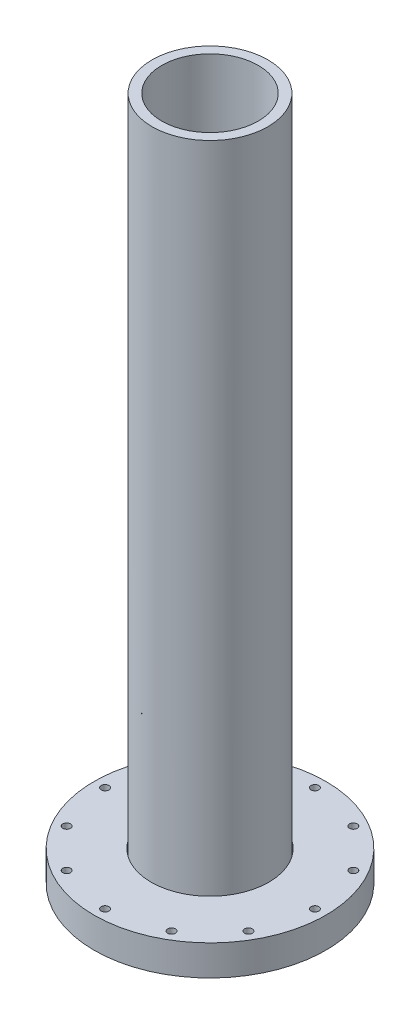
from build123d import *

# Parameters (mm, degrees)
SKETCH1_R                        = 38.1
SKETCH1_R_2                      = 31.75
BOSS_EXTRUDE1_DEPTH              = 450
SKETCH2_R                        = 76.2
SKETCH2_R_2                      = 38.6715
BOSS_EXTRUDE2_DEPTH              = 20
SKETCH5_W                        = 2.5527
SKETCH5_H                        = 450
F_10_CLEARANCE_HOLE1_AT_2_COUNT  = 2
F_10_CLEARANCE_HOLE1_AT_2_PITCH  = 35.717028224
F_10_CLEARANCE_HOLE1_AT_3_COUNT  = 2
F_10_CLEARANCE_HOLE1_AT_3_PITCH  = 69
F_10_CLEARANCE_HOLE1_AT_4_COUNT  = 2
F_10_CLEARANCE_HOLE1_AT_4_PITCH  = 97.580735804
F_10_CLEARANCE_HOLE1_AT_5_COUNT  = 2
F_10_CLEARANCE_HOLE1_AT_5_PITCH  = 119.511505722
F_10_CLEARANCE_HOLE1_AT_6_COUNT  = 2
F_10_CLEARANCE_HOLE1_AT_6_PITCH  = 133.297764028
F_10_CLEARANCE_HOLE1_AT_7_COUNT  = 2
F_10_CLEARANCE_HOLE1_AT_7_PITCH  = 138
F_10_CLEARANCE_HOLE1_AT_8_COUNT  = 2
F_10_CLEARANCE_HOLE1_AT_8_PITCH  = 133.297764028
F_10_CLEARANCE_HOLE1_AT_9_COUNT  = 2
F_10_CLEARANCE_HOLE1_AT_9_PITCH  = 119.511505722
F_10_CLEARANCE_HOLE1_AT_10_COUNT = 2
F_10_CLEARANCE_HOLE1_AT_10_PITCH = 97.580735804
F_10_CLEARANCE_HOLE1_AT_11_COUNT = 2
F_10_CLEARANCE_HOLE1_AT_11_PITCH = 69
F_10_CLEARANCE_HOLE1_AT_12_COUNT = 2
F_10_CLEARANCE_HOLE1_AT_12_PITCH = 35.717028224
SKETCH6_R                        = 55.14
CUT_EXTRUDE1_DEPTH               = 2


with BuildPart() as part:
    # Sketch1 → Boss-Extrude1 (new body)
    with BuildSketch(Plane(origin=(0, 0, 0), x_dir=(1, 0, 0), z_dir=(0, 1, 0))):
        Circle(SKETCH1_R)
        Circle(SKETCH1_R_2, mode=Mode.SUBTRACT)
    extrude(amount=BOSS_EXTRUDE1_DEPTH)


with BuildPart() as body_2:
    # Sketch2 → Boss-Extrude2 (new body)
    with BuildSketch(Plane(origin=(0, 0, 0), x_dir=(1, 0, 0), z_dir=(0, 1, 0))):
        Circle(SKETCH2_R)
        Circle(SKETCH2_R_2, mode=Mode.SUBTRACT)
    extrude(amount=BOSS_EXTRUDE2_DEPTH)

    # Sketch5 → #10 Clearance Hole1 (revolve, cut)
    with BuildSketch(Plane(origin=(69, 0, 0), x_dir=(0, 0, -1), z_dir=(1, 0, 0))):
        with Locations((1.27635, 225)):
            Rectangle(SKETCH5_W, SKETCH5_H)
    f_10_clearance_hole1 = revolve(axis=Axis((69, -6.35, 0), (0, 1, 0)), mode=Mode.SUBTRACT)

    # #10 Clearance Hole1 at 2: #10 Clearance Hole1 ×2
    with Locations(*[Vector(-0.25881904510252135, 0, -0.9659258262890681) * (i * F_10_CLEARANCE_HOLE1_AT_2_PITCH) for i in range(1, F_10_CLEARANCE_HOLE1_AT_2_COUNT)]):
        add(f_10_clearance_hole1, mode=Mode.SUBTRACT)

    # #10 Clearance Hole1 at 3: #10 Clearance Hole1 ×2
    with Locations(*[Vector(-0.5000000000000009, 0, -0.8660254037844382) * (i * F_10_CLEARANCE_HOLE1_AT_3_PITCH) for i in range(1, F_10_CLEARANCE_HOLE1_AT_3_COUNT)]):
        add(f_10_clearance_hole1, mode=Mode.SUBTRACT)

    # #10 Clearance Hole1 at 4: #10 Clearance Hole1 ×2
    with Locations(*[Vector(-0.7071067811865487, 0, -0.7071067811865464) * (i * F_10_CLEARANCE_HOLE1_AT_4_PITCH) for i in range(1, F_10_CLEARANCE_HOLE1_AT_4_COUNT)]):
        add(f_10_clearance_hole1, mode=Mode.SUBTRACT)

    # #10 Clearance Hole1 at 5: #10 Clearance Hole1 ×2
    with Locations(*[Vector(-0.8660254037844397, 0, -0.49999999999999817) * (i * F_10_CLEARANCE_HOLE1_AT_5_PITCH) for i in range(1, F_10_CLEARANCE_HOLE1_AT_5_COUNT)]):
        add(f_10_clearance_hole1, mode=Mode.SUBTRACT)

    # #10 Clearance Hole1 at 6: #10 Clearance Hole1 ×2
    with Locations(*[Vector(-0.9659258262890691, 0, -0.258819045102518) * (i * F_10_CLEARANCE_HOLE1_AT_6_PITCH) for i in range(1, F_10_CLEARANCE_HOLE1_AT_6_COUNT)]):
        add(f_10_clearance_hole1, mode=Mode.SUBTRACT)

    # #10 Clearance Hole1 at 7: #10 Clearance Hole1 ×2
    with Locations(*[(-i * F_10_CLEARANCE_HOLE1_AT_7_PITCH, 0, 0) for i in range(1, F_10_CLEARANCE_HOLE1_AT_7_COUNT)]):
        add(f_10_clearance_hole1, mode=Mode.SUBTRACT)

    # #10 Clearance Hole1 at 8: #10 Clearance Hole1 ×2
    with Locations(*[Vector(-0.9659258262890672, 0, 0.2588190451025248) * (i * F_10_CLEARANCE_HOLE1_AT_8_PITCH) for i in range(1, F_10_CLEARANCE_HOLE1_AT_8_COUNT)]):
        add(f_10_clearance_hole1, mode=Mode.SUBTRACT)

    # #10 Clearance Hole1 at 9: #10 Clearance Hole1 ×2
    with Locations(*[Vector(-0.8660254037844364, 0, 0.500000000000004) * (i * F_10_CLEARANCE_HOLE1_AT_9_PITCH) for i in range(1, F_10_CLEARANCE_HOLE1_AT_9_COUNT)]):
        add(f_10_clearance_hole1, mode=Mode.SUBTRACT)

    # #10 Clearance Hole1 at 10: #10 Clearance Hole1 ×2
    with Locations(*[Vector(-0.7071067811865439, 0, 0.7071067811865512) * (i * F_10_CLEARANCE_HOLE1_AT_10_PITCH) for i in range(1, F_10_CLEARANCE_HOLE1_AT_10_COUNT)]):
        add(f_10_clearance_hole1, mode=Mode.SUBTRACT)

    # #10 Clearance Hole1 at 11: #10 Clearance Hole1 ×2
    with Locations(*[Vector(-0.49999999999999495, 0, 0.8660254037844416) * (i * F_10_CLEARANCE_HOLE1_AT_11_PITCH) for i in range(1, F_10_CLEARANCE_HOLE1_AT_11_COUNT)]):
        add(f_10_clearance_hole1, mode=Mode.SUBTRACT)

    # #10 Clearance Hole1 at 12: #10 Clearance Hole1 ×2
    with Locations(*[Vector(-0.25881904510251413, 0, 0.96592582628907) * (i * F_10_CLEARANCE_HOLE1_AT_12_PITCH) for i in range(1, F_10_CLEARANCE_HOLE1_AT_12_COUNT)]):
        add(f_10_clearance_hole1, mode=Mode.SUBTRACT)


with BuildPart() as cut_extrude1_tool:
    # Sketch6 → Cut-Extrude1 (new body)
    with BuildSketch(Plane.XZ):
        Circle(SKETCH6_R)
    extrude(amount=-CUT_EXTRUDE1_DEPTH)


with BuildPart() as part_1:
    add(part.part)

    # Cut-Extrude1: cut by cut_extrude1_tool
    add(cut_extrude1_tool.part, mode=Mode.SUBTRACT)


with BuildPart() as body_2_1:
    add(body_2.part)

    # Cut-Extrude1: cut by cut_extrude1_tool
    add(cut_extrude1_tool.part, mode=Mode.SUBTRACT)


solid = Compound([part_1.part, body_2_1.part])
